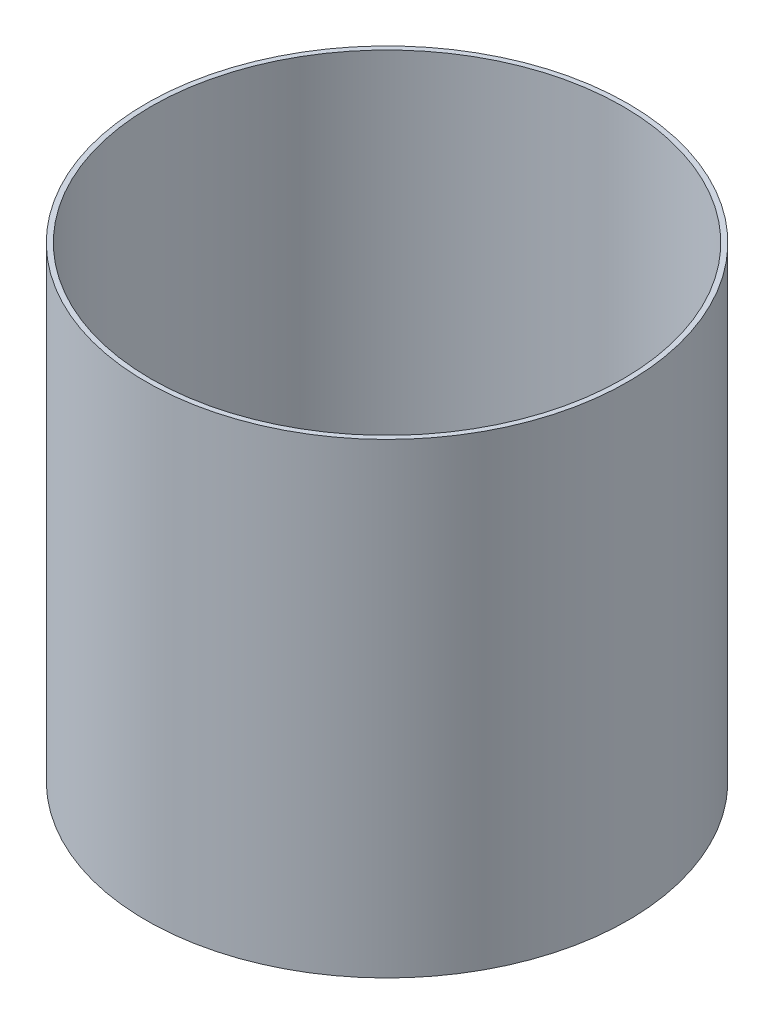
from build123d import *

# Parameters (mm, degrees)
SKETCH1_W = 16
SKETCH1_H = 1500


with BuildPart() as part:
    # Sketch1 → Revolve1 (revolve)
    with BuildSketch(Plane.XY, mode=Mode.PRIVATE) as revolve1_sk:
        with Locations((767, 750)):
            Rectangle(SKETCH1_W, SKETCH1_H)
    revolve(revolve1_sk.sketch.rotate(Axis((0, 0, 0), (0, 1, 0)), 90), axis=Axis((0, 0, 0), (0, 1, 0)))


solid = part.part
